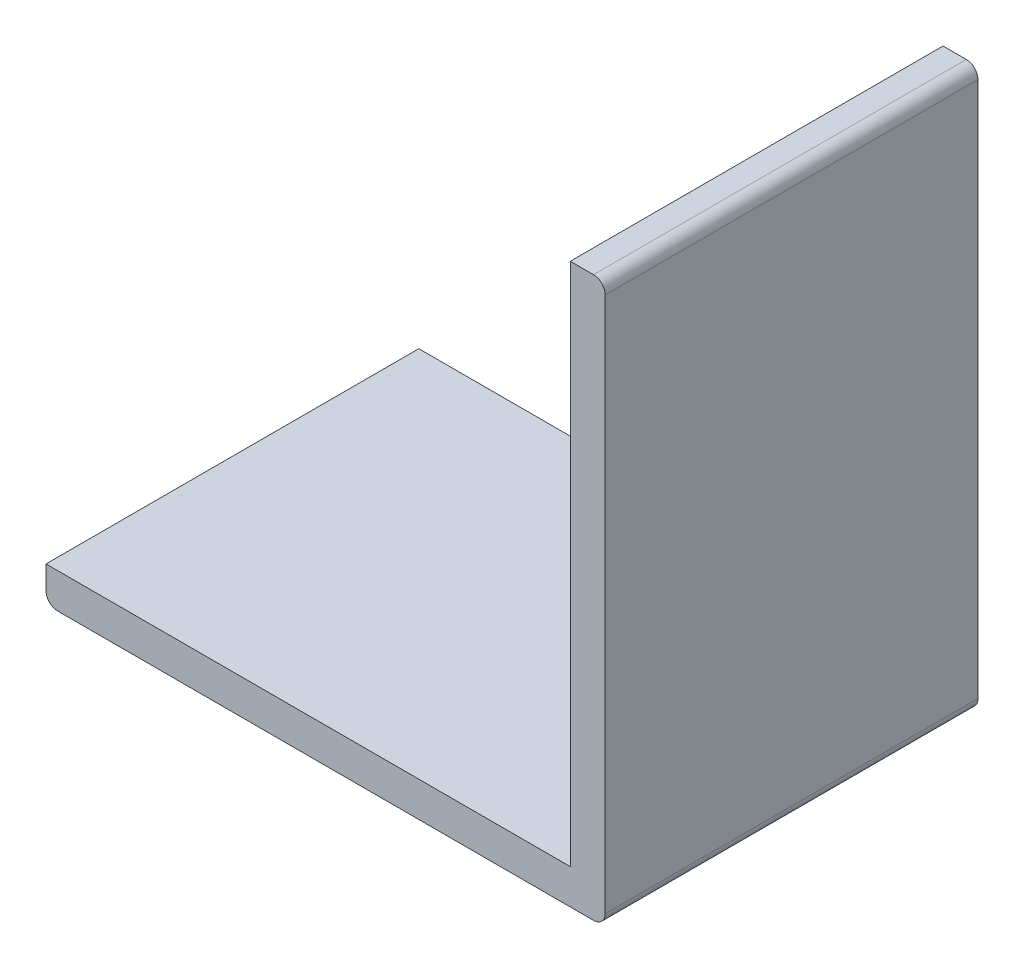
from build123d import *

# Parameters (mm, degrees)
BOSS_EXTRUDE1_DEPTH = 101.6


with BuildPart() as part:
    # Sketch1 → Boss-Extrude1 (new body)
    with BuildSketch(Plane.XY):
        with BuildLine():
            Line((-101.6, -5178.34108), (-101.6, -5168.81608))
            Line((-101.6, -5168.81608), (-190.441035714, -5168.81608))
            Line((-190.441035714, -5168.81608), (-190.441035714, -5175.16608))
            ThreePointArc((-190.441035714, -5175.16608), (-189.511099745, -5177.41114403), (-187.266035714, -5178.34108))
            Line((-187.266035714, -5178.34108), (-101.6, -5178.34108))
        make_face()
        with BuildLine():
            Line((-38.041035714, -5168.81608), (-47.566035714, -5168.81608))
            Line((-47.566035714, -5168.81608), (-53.408035714, -5168.81608))
            Line((-53.408035714, -5168.81608), (-101.6, -5168.81608))
            Line((-101.6, -5168.81608), (-101.6, -5178.34108))
            Line((-101.6, -5178.34108), (-41.216035714, -5178.34108))
            ThreePointArc((-41.216035714, -5178.34108), (-38.970971684, -5177.41114403), (-38.041035714, -5175.16608))
            Line((-38.041035714, -5175.16608), (-38.041035714, -5168.81608))
        make_face()
        with BuildLine():
            Line((-47.566035714, -5025.94108), (-47.566035714, -5168.81608))
            Line((-47.566035714, -5168.81608), (-38.041035714, -5168.81608))
            Line((-38.041035714, -5168.81608), (-38.041035714, -5029.11608))
            ThreePointArc((-38.041035714, -5029.11608), (-38.970971684, -5026.87101597), (-41.216035714, -5025.94108))
            Line((-41.216035714, -5025.94108), (-47.566035714, -5025.94108))
        make_face()
    extrude(amount=-BOSS_EXTRUDE1_DEPTH)


solid = part.part
